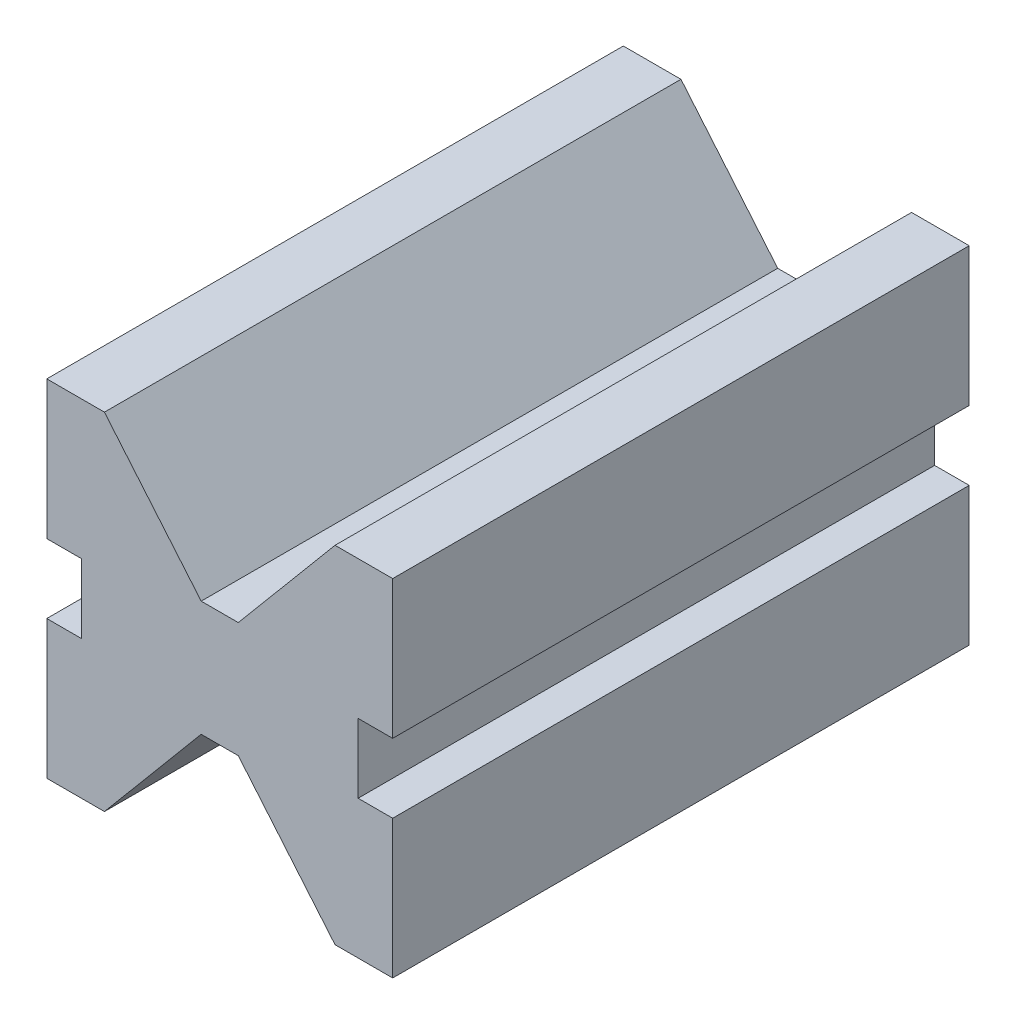
from build123d import *

# Parameters (mm, degrees)
BOSS_EXTRUDE1_DEPTH = 50


with BuildPart() as part:
    # Sketch1 → Boss-Extrude1 (new, symmetric)
    with BuildSketch(Plane.XY):
        Polygon((30, -6), (30, -30), (20, -30), (3.218007376, -10), (-3.218007376, -10), (-20, -30), (-30, -30), (-30, -6), (-24, -6), (-24, 6), (-30, 6), (-30, 30), (-20, 30), (-3.218007376, 10), (3.218007376, 10), (20, 30), (30, 30), (30, 6), (24, 6), (24, -6), align=None)
    extrude(amount=BOSS_EXTRUDE1_DEPTH, both=True)


solid = part.part
